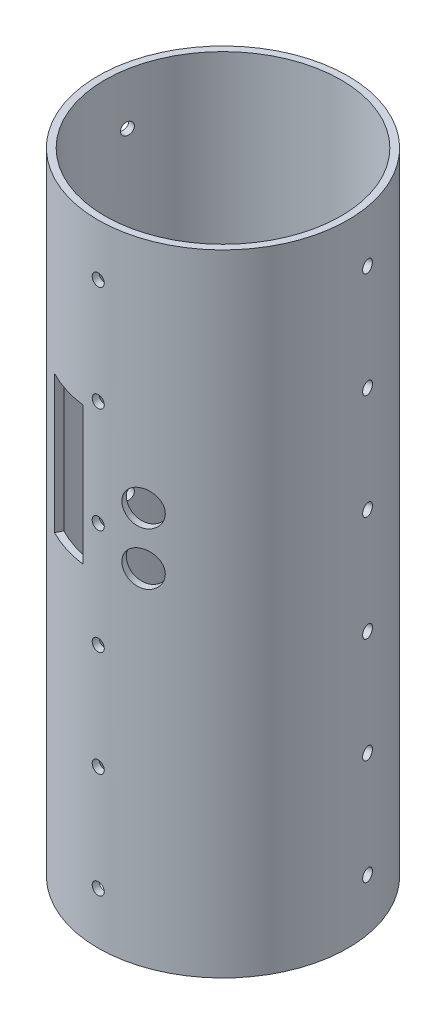
from build123d import *

# Parameters (mm, degrees)
SKETCH1_R               = 36.25
SKETCH1_R_2             = 34.25
BULK_DEPTH              = 183
SKETCH2_R               = 1.75
FRONT_HOLE_CUTOUT_DEPTH = 191.045060446
CIRPATTERN1_COUNT       = 2
CIRPATTERN1_ANGLE       = 100
MIRROR1_COPY_1_SKETCH_R = 1.75
MIRROR1_COPY_1_DEPTH    = 191.045060446
MIRROR1_COPY_2_SKETCH_R = 1.75
MIRROR1_COPY_2_DEPTH    = 191.045060446
SKETCH3_W               = 40
SKETCH3_H               = 50
CUT_REVOLVE1_ANGLE      = 20
CUT_EXTRUDE2_REACH      = 203.849
CUT_EXTRUDE2_END_RADIUS = 34.25
SKETCH4_R               = 5


with BuildPart() as part:
    # Sketch1 → BULK (new body)
    with BuildSketch(Plane(origin=(0, 0, 0), x_dir=(1, 0, 0), z_dir=(0, 1, 0))):
        with Locations(Location((0, 0, 0), (0, 0, 270))):
            Circle(SKETCH1_R)
        with Locations(Location((0, 0, 0), (0, 0, 270))):
            Circle(SKETCH1_R_2, mode=Mode.SUBTRACT)
    extrude(amount=BULK_DEPTH)

    # Sketch2 → FRONT HOLE CUTOUT (cut, through all)
    with BuildSketch(Plane.XY):
        with Locations(Location((0, 15, 0), (0, 0, 270.000000034))):
            Circle(SKETCH2_R)
        with Locations(Location((0, 45.6, 0), (0, 0, 270.000000034))):
            Circle(SKETCH2_R)
        with Locations(Location((0, 76.2, 0), (0, 0, 270.000000034))):
            Circle(SKETCH2_R)
        with Locations(Location((0, 106.8, 0), (0, 0, 270.000000034))):
            Circle(SKETCH2_R)
        with Locations(Location((0, 137.4, 0), (0, 0, 270.000000034))):
            Circle(SKETCH2_R)
        with Locations(Location((0, 168, 0), (0, 0, 270.000000034))):
            Circle(SKETCH2_R)
    front_hole_cutout = extrude(amount=FRONT_HOLE_CUTOUT_DEPTH, mode=Mode.SUBTRACT)

    # CirPattern1: FRONT HOLE CUTOUT ×2 about axis
    cirpattern1_axis = Axis((0, 146.5, 0), (0, -1, 0))
    for i in range(1, CIRPATTERN1_COUNT):
        add(front_hole_cutout.rotate(cirpattern1_axis, i * CIRPATTERN1_ANGLE / (CIRPATTERN1_COUNT - 1)), mode=Mode.SUBTRACT)

    # Mirror1 copy 1 sketch → Mirror1 copy 1 (cut, through all)
    with BuildSketch(Plane(origin=(0, 0, 0), x_dir=(0.17364817766693424, 0, 0.9848077530122074), z_dir=(0.9848077530122074, 0, -0.17364817766693424))):
        with Locations((0, -15)):
            Circle(MIRROR1_COPY_1_SKETCH_R)
        with Locations((0, -45.6)):
            Circle(MIRROR1_COPY_1_SKETCH_R)
        with Locations((0, -76.2)):
            Circle(MIRROR1_COPY_1_SKETCH_R)
        with Locations((0, -106.8)):
            Circle(MIRROR1_COPY_1_SKETCH_R)
        with Locations((0, -137.4)):
            Circle(MIRROR1_COPY_1_SKETCH_R)
        with Locations((0, -168)):
            Circle(MIRROR1_COPY_1_SKETCH_R)
    extrude(amount=MIRROR1_COPY_1_DEPTH, mode=Mode.SUBTRACT)

    # Mirror1 copy 2 sketch → Mirror1 copy 2 (cut, through all)
    with BuildSketch(Plane(origin=(0, 0, 0), x_dir=(-1, 0, 0), z_dir=(0, 0, 1))):
        with Locations((0, -15)):
            Circle(MIRROR1_COPY_2_SKETCH_R)
        with Locations((0, -45.6)):
            Circle(MIRROR1_COPY_2_SKETCH_R)
        with Locations((0, -76.2)):
            Circle(MIRROR1_COPY_2_SKETCH_R)
        with Locations((0, -106.8)):
            Circle(MIRROR1_COPY_2_SKETCH_R)
        with Locations((0, -137.4)):
            Circle(MIRROR1_COPY_2_SKETCH_R)
        with Locations((0, -168)):
            Circle(MIRROR1_COPY_2_SKETCH_R)
    extrude(amount=MIRROR1_COPY_2_DEPTH, mode=Mode.SUBTRACT)

    # Sketch3 → Cut-Revolve1 (revolve, cut)
    with BuildSketch(Plane(origin=(0, 0, 0), x_dir=(0, -1, 0), z_dir=(0.9914448613738104, 0, 0.13052619222005188))):
        with Locations((-114.02, -25)):
            Rectangle(SKETCH3_W, SKETCH3_H)
    revolve(axis=Axis((0, 146.5, 0), (0, -1, 0)), revolution_arc=CUT_REVOLVE1_ANGLE, mode=Mode.SUBTRACT)

    # Cut-Extrude2: up to this cylinder (the profile starts outside it)
    cut_extrude2_end = Plane(origin=(0, 107.7, 0), z_dir=(0, -1, 0)) * Cylinder(CUT_EXTRUDE2_END_RADIUS, 492.398, mode=Mode.PRIVATE)
    # Sketch4 → Cut-Extrude2 (cut, up to the surface)
    with BuildSketch(Plane(origin=(11.201866046, 0, 34.475798716), x_dir=(0.9510565162951534, 0, -0.3090169943749481), z_dir=(0.3090169943749481, 0, 0.9510565162951534)), mode=Mode.PRIVATE) as cut_extrude2_sk1:
        with Locations((0, 115.3)):
            Circle(SKETCH4_R)
    cut_extrude2_tool1 = extrude(cut_extrude2_sk1.sketch, amount=-CUT_EXTRUDE2_REACH, mode=Mode.PRIVATE) - cut_extrude2_end
    add(cut_extrude2_tool1.solids().sort_by_distance((11.201866, 115.3, 34.475799))[0], mode=Mode.SUBTRACT)
    # Sketch4 → Cut-Extrude2 (cut, up to the surface)
    with BuildSketch(Plane(origin=(11.201866046, 0, 34.475798716), x_dir=(0.9510565162951534, 0, -0.3090169943749481), z_dir=(0.3090169943749481, 0, 0.9510565162951534)), mode=Mode.PRIVATE) as cut_extrude2_sk2:
        with Locations((0, 100.1)):
            Circle(SKETCH4_R)
    cut_extrude2_tool2 = extrude(cut_extrude2_sk2.sketch, amount=-CUT_EXTRUDE2_REACH, mode=Mode.PRIVATE) - cut_extrude2_end
    add(cut_extrude2_tool2.solids().sort_by_distance((11.201866, 100.1, 34.475799))[0], mode=Mode.SUBTRACT)


solid = part.part
